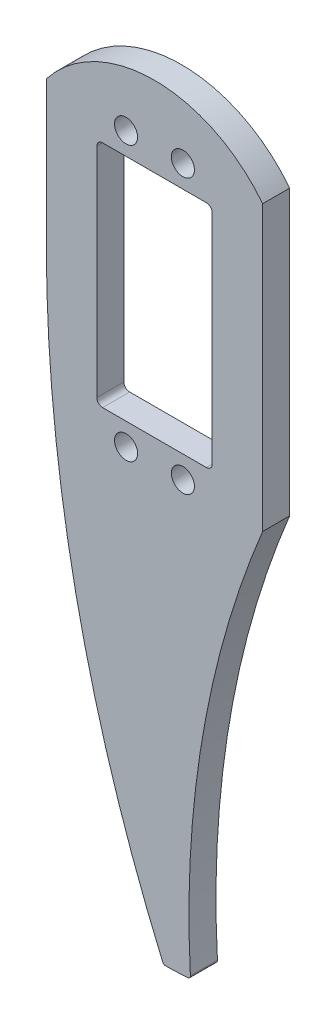
from build123d import *

# Parameters (mm, degrees)
SKETCH1_R           = 2.032
SKETCH1_W           = 20.32
SKETCH1_H           = 40.386
BOSS_EXTRUDE1_DEPTH = 4.7625
FILLET1_R           = 1.016
FILLET2_R           = 0.508


with BuildPart() as part:
    # Sketch1 → Boss-Extrude1 (new body)
    with BuildSketch(Plane.XY):
        with BuildLine():
            Line((0, -49.992035626), (0, 0))
            ThreePointArc((0, 0), (-19.05, 9.319382187), (-38.1, 0))
            Line((-38.1, 0), (-38.1, -24.996017813))
            ThreePointArc((-38.1, -24.996017813), (-32.885821078, -75.953581503), (-17.459395355, -124.799117107))
            ThreePointArc((-17.459395355, -124.799117107), (-15.078767061, -124.73890948), (-12.7, -124.627180771))
            ThreePointArc((-12.7, -124.627180771), (-10.590712033, -86.588003883), (0, -49.992035626))
        make_face()
        with Locations(Location((-14.0462, -0.866017813, 0), (0, 0, 180))):
            Circle(SKETCH1_R, mode=Mode.SUBTRACT)
        with Locations(Location((-24.0538, -0.866017813, 0), (0, 0, 180))):
            Circle(SKETCH1_R, mode=Mode.SUBTRACT)
        with Locations(Location((-24.0538, -49.126017813, 0), (0, 0, 180))):
            Circle(SKETCH1_R, mode=Mode.SUBTRACT)
        with Locations(Location((-14.0462, -49.126017813, 0), (0, 0, 180))):
            Circle(SKETCH1_R, mode=Mode.SUBTRACT)
        with Locations((-19.05, -24.996017813)):
            Rectangle(SKETCH1_W, SKETCH1_H, mode=Mode.SUBTRACT)
    extrude(amount=BOSS_EXTRUDE1_DEPTH)

    # Fillet1
    fillet1_edges = [part.edges().sort_by_distance(p)[0] for p in [
        (-8.89, -45.189017813, 2.38125),
        (-8.89, -4.803017813, 2.38125),
        (-29.21, -4.803017813, 2.38125),
        (-29.21, -45.189017813, 2.38125),
    ]]
    fillet(fillet1_edges, radius=FILLET1_R)

    # Fillet2
    fillet2_edges = [part.edges().sort_by_distance(p)[0] for p in [
        (-12.7, -124.627180771, 2.38125),
        (-17.459395355, -124.799117107, 2.38125),
    ]]
    fillet(fillet2_edges, radius=FILLET2_R)


solid = part.part
